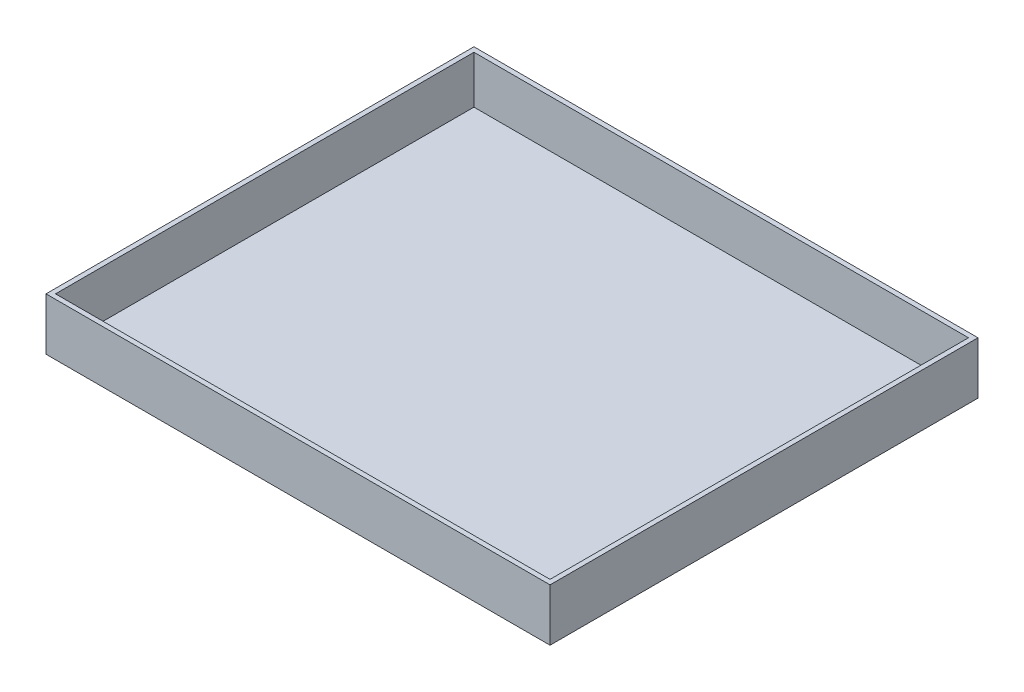
from build123d import *

# Parameters (mm, degrees)
CROQUIS1_W            = 530
CROQUIS1_H            = 450
CROQUIS1_W_2          = 520
CROQUIS1_H_2          = 440
EXTRUIR_L_MINA1_DEPTH = 50
CROQUIS2_W            = 530
CROQUIS2_H            = 450
EXTRUIR1_DEPTH        = 5


with BuildPart() as part:
    # Croquis1 → Extruir-Lámina1 (new body)
    with BuildSketch(Plane(origin=(0, 0, 0), x_dir=(1, 0, 0), z_dir=(0, 1, 0))):
        Rectangle(CROQUIS1_W, CROQUIS1_H)
        Rectangle(CROQUIS1_W_2, CROQUIS1_H_2, mode=Mode.SUBTRACT)
    extrude(amount=-EXTRUIR_L_MINA1_DEPTH)

    # Croquis2 → Extruir1 (add)
    with BuildSketch(Plane.XZ.offset(50)):
        Rectangle(CROQUIS2_W, CROQUIS2_H)
    extrude(amount=EXTRUIR1_DEPTH)


solid = part.part
